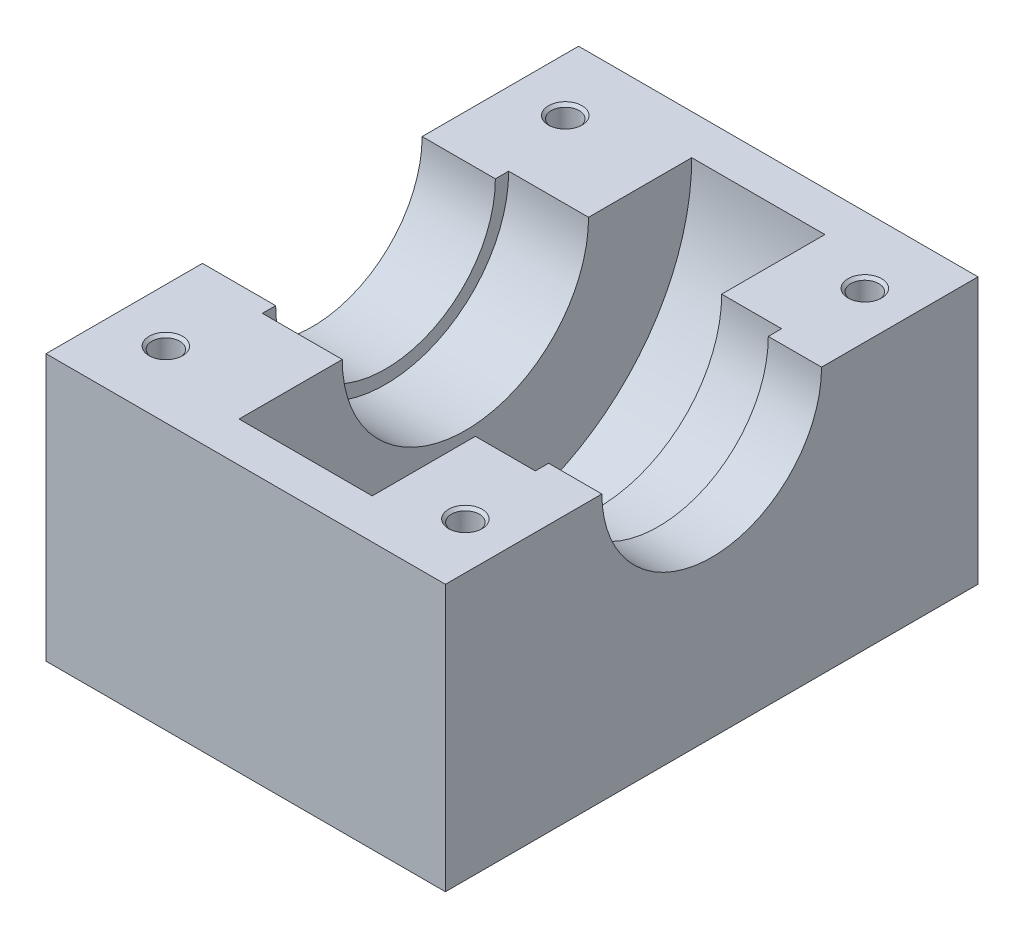
from build123d import *

# Parameters (mm, degrees)
SCHIZZO1_W                          = 60
SCHIZZO1_H                          = 80
ESTRUSIONE_ESTRUSIONE1_DEPTH        = 40
TAGLIO_ESTRUSIONE1_REACH            = 84.462
TAGLIO_ESTRUSIONE2_START            = -8
TAGLIO_ESTRUSIONE2_DEPTH            = 9
TAGLIO_ESTRUSIONE3_START            = -23
TAGLIO_ESTRUSIONE3_DEPTH            = 12
TAGLIO_ESTRUSIONE4_START            = -43
TAGLIO_ESTRUSIONE4_DEPTH            = 20
FORO_FILETTATO_M5X0_8_1_D           = 4.2
FORO_FILETTATO_M5X0_8_1_DEPTH       = 12.7381927
FORO_FILETTATO_M5X0_8_1_CSINK_D     = 5.05
FORO_FILETTATO_M5X0_8_1_CSINK_ANGLE = 90
FORO_FILETTATO_M5X0_8_1_TIP         = 1.2618073


with BuildPart() as part:
    # Schizzo1 → Estrusione-Estrusione1 (new body)
    with BuildSketch(Plane(origin=(0, 0, 0), x_dir=(1, 0, 0), z_dir=(0, 1, 0))):
        Rectangle(SCHIZZO1_W, SCHIZZO1_H)
    extrude(amount=ESTRUSIONE_ESTRUSIONE1_DEPTH)

    # Schizzo2 → Taglio-Estrusione1 (cut, up to next)
    with BuildSketch(Plane(origin=(30, 0, 0), x_dir=(0, 0, -1), z_dir=(1, 0, 0)), mode=Mode.PRIVATE) as taglio_estrusione1_sk1:
        with BuildLine():
            Line((-16.5, 40), (16.5, 40))
            ThreePointArc((16.5, 40), (0, 23.5), (-16.5, 40))
        make_face()
    taglio_estrusione1_tool1 = extrude(taglio_estrusione1_sk1.sketch, amount=-TAGLIO_ESTRUSIONE1_REACH, mode=Mode.PRIVATE) & part.part
    add(taglio_estrusione1_tool1.solids().sort_by_distance((30, 32.997183, 0))[0], mode=Mode.SUBTRACT)

    # Schizzo3 → Taglio-Estrusione2 (cut)
    with BuildSketch(Plane(origin=(30, 0, 0), x_dir=(0, 0, -1), z_dir=(1, 0, 0)).offset(TAGLIO_ESTRUSIONE2_START)):
        with BuildLine():
            Line((16.5, 40), (18.5, 40))
            ThreePointArc((18.5, 40), (0, 21.5), (-18.5, 40))
            Line((-18.5, 40), (-16.5, 40))
            ThreePointArc((-16.5, 40), (0, 23.5), (16.5, 40))
        make_face()
    extrude(amount=-TAGLIO_ESTRUSIONE2_DEPTH, mode=Mode.SUBTRACT)

    # Schizzo4 → Taglio-Estrusione3 (cut)
    with BuildSketch(Plane.ZY.offset(30).offset(TAGLIO_ESTRUSIONE3_START)):
        with BuildLine():
            Line((16.5, 40), (18.5, 40))
            ThreePointArc((18.5, 40), (0, 21.5), (-18.5, 40))
            Line((-18.5, 40), (-16.5, 40))
            ThreePointArc((-16.5, 40), (0, 23.5), (16.5, 40))
        make_face()
    extrude(amount=TAGLIO_ESTRUSIONE3_DEPTH, mode=Mode.SUBTRACT)

    # Schizzo5 → Taglio-Estrusione4 (cut)
    with BuildSketch(Plane.ZY.offset(30).offset(TAGLIO_ESTRUSIONE4_START)):
        with BuildLine():
            Line((16.5, 40), (34, 40))
            ThreePointArc((34, 40), (0, 6), (-34, 40))
            Line((-34, 40), (-16.5, 40))
            ThreePointArc((-16.5, 40), (0, 23.5), (16.5, 40))
        make_face()
    extrude(amount=TAGLIO_ESTRUSIONE4_DEPTH, mode=Mode.SUBTRACT)

    # Foro filettato M5x0.8-1
    with Locations(Plane(origin=(-22, 40, -30), x_dir=(0, 0, 1), z_dir=(0, 1, 0))):
        with Locations((0, 0), (0, 45), (60, 0), (60, 45)):
            CounterSinkHole(FORO_FILETTATO_M5X0_8_1_D / 2, FORO_FILETTATO_M5X0_8_1_CSINK_D / 2, depth=FORO_FILETTATO_M5X0_8_1_DEPTH, counter_sink_angle=FORO_FILETTATO_M5X0_8_1_CSINK_ANGLE)
            with Locations((0, 0, -(FORO_FILETTATO_M5X0_8_1_DEPTH + FORO_FILETTATO_M5X0_8_1_TIP / 2))):  # 118° drill point
                Cone(0, FORO_FILETTATO_M5X0_8_1_D / 2, FORO_FILETTATO_M5X0_8_1_TIP, mode=Mode.SUBTRACT)


solid = part.part
